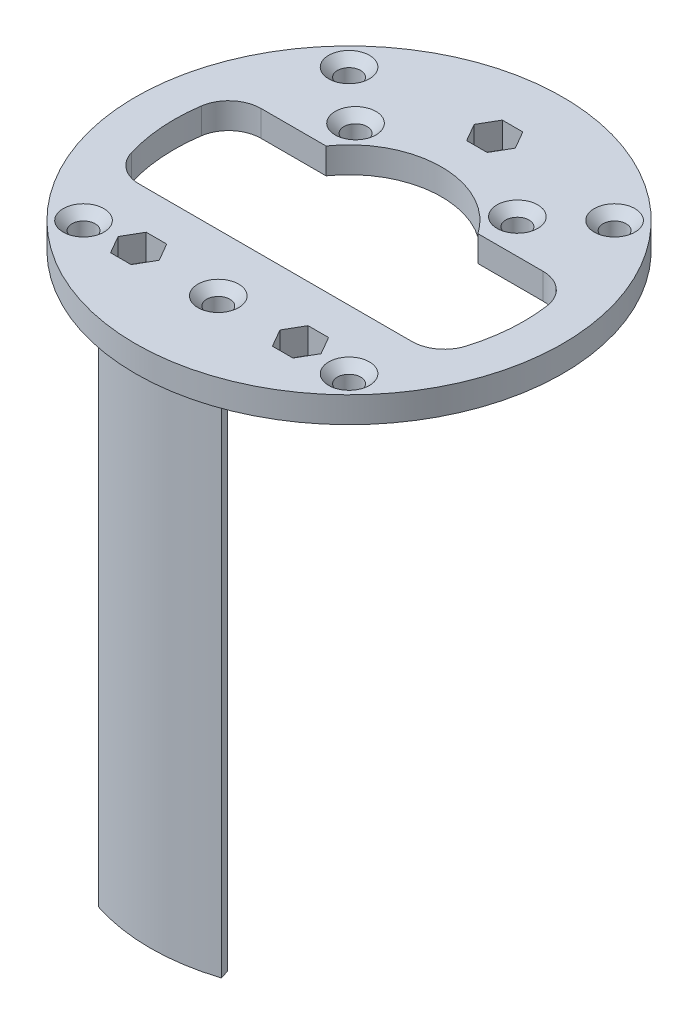
from build123d import *

# Parameters (mm, degrees)
SKETCH1_R                                       = 33
SKETCH1_R_2                                     = 27
BOSS_EXTRUDE1_DEPTH                             = 4
SALIENTE_EXTRUIR1_START                         = -4
SKETCH2_R                                       = 1.5
SALIENTE_EXTRUIR1_DEPTH                         = 4
CORTAR_EXTRUIR1_REACH                           = 48.84
CROQUIS1_R                                      = 1.75
CSK_FOR_M3_FLAT_HEAD_MACHINE_SCREW1_D           = 3.6
CSK_FOR_M3_FLAT_HEAD_MACHINE_SCREW1_CSINK_D     = 6.3
CSK_FOR_M3_FLAT_HEAD_MACHINE_SCREW1_CSINK_ANGLE = 90
CSK_FOR_M3_FLAT_HEAD_MACHINE_SCREW2_D           = 3.6
CSK_FOR_M3_FLAT_HEAD_MACHINE_SCREW2_CSINK_D     = 6.3
CSK_FOR_M3_FLAT_HEAD_MACHINE_SCREW2_CSINK_ANGLE = 90
FILLET1_R                                       = 5
BOSS_EXTRUDE2_DEPTH                             = 78
FILLET2_R                                       = 2


with BuildPart() as part:
    # Sketch1 → Boss-Extrude1 (new body)
    with BuildSketch(Plane(origin=(0, 0, 0), x_dir=(1, 0, 0), z_dir=(0, 1, 0))):
        with Locations(Location((0, 0, 0), (0, 0, 270))):
            Circle(SKETCH1_R)
        with Locations(Location((0, 0, 0), (0, 0, 270))):
            Circle(SKETCH1_R_2, mode=Mode.SUBTRACT)
    extrude(amount=BOSS_EXTRUDE1_DEPTH)

    # Sketch2 → Saliente-Extruir1 (add)
    # profile 1 of 2: a face of its own
    with BuildSketch(Plane(origin=(0, 4, 0), x_dir=(1, 0, 0), z_dir=(0, 1, 0)).offset(SALIENTE_EXTRUIR1_START)):
        with BuildLine():
            Line((-24.5, -11.346805718), (24.5, -11.346805718))
            ThreePointArc((24.5, -11.346805718), (0, -27), (-24.5, -11.346805718))
        make_face()
        with Locations(Location((0, -20.2, 0), (0, 0, 270))):
            Circle(SKETCH2_R, mode=Mode.SUBTRACT)
    # profile 2 of 2: a face of its own
    with BuildSketch(Plane(origin=(0, 4, 0), x_dir=(1, 0, 0), z_dir=(0, 1, 0)).offset(SALIENTE_EXTRUIR1_START)):
        with BuildLine():
            Line((-25.7325, 8.175478197), (-11.7325, 8.175478197))
            ThreePointArc((-11.7325, 8.175478197), (0, 14.3), (11.7325, 8.175478197))
            Line((11.7325, 8.175478197), (25.7325, 8.175478197))
            ThreePointArc((25.7325, 8.175478197), (0, 27), (-25.7325, 8.175478197))
        make_face()
        with Locations(Location((-12.5, 13.5, 0), (0, 0, 270))):
            Circle(SKETCH2_R, mode=Mode.SUBTRACT)
        with Locations(Location((12.5, 13.5, 0), (0, 0, 270))):
            Circle(SKETCH2_R, mode=Mode.SUBTRACT)
    extrude(amount=SALIENTE_EXTRUIR1_DEPTH)

    # Croquis1 → Cortar-Extruir1 (cut, up to next)
    with BuildSketch(Plane(origin=(0, 4, 0), x_dir=(1, 0, 0), z_dir=(0, 1, 0)), mode=Mode.PRIVATE) as cortar_extruir1_sk1:
        with Locations(Location((-20.506096654, 20.506096654, 0), (0, 0, 270))):
            Circle(CROQUIS1_R)
    cortar_extruir1_tool1 = extrude(cortar_extruir1_sk1.sketch, amount=-CORTAR_EXTRUIR1_REACH, mode=Mode.PRIVATE) & part.part
    # Croquis1 → Cortar-Extruir1 (cut, up to next)
    with BuildSketch(Plane(origin=(0, 4, 0), x_dir=(1, 0, 0), z_dir=(0, 1, 0)), mode=Mode.PRIVATE) as cortar_extruir1_sk2:
        with Locations(Location((20.506096654, 20.506096654, 0), (0, 0, 270))):
            Circle(CROQUIS1_R)
    cortar_extruir1_tool2 = extrude(cortar_extruir1_sk2.sketch, amount=-CORTAR_EXTRUIR1_REACH, mode=Mode.PRIVATE) & part.part
    # Croquis1 → Cortar-Extruir1 (cut, up to next)
    with BuildSketch(Plane(origin=(0, 4, 0), x_dir=(1, 0, 0), z_dir=(0, 1, 0)), mode=Mode.PRIVATE) as cortar_extruir1_sk3:
        with Locations(Location((-20.506096654, -20.506096654, 0), (0, 0, 270))):
            Circle(CROQUIS1_R)
    cortar_extruir1_tool3 = extrude(cortar_extruir1_sk3.sketch, amount=-CORTAR_EXTRUIR1_REACH, mode=Mode.PRIVATE) & part.part
    # Croquis1 → Cortar-Extruir1 (cut, up to next)
    with BuildSketch(Plane(origin=(0, 4, 0), x_dir=(1, 0, 0), z_dir=(0, 1, 0)), mode=Mode.PRIVATE) as cortar_extruir1_sk4:
        with Locations(Location((20.506096654, -20.506096654, 0), (0, 0, 270))):
            Circle(CROQUIS1_R)
    cortar_extruir1_tool4 = extrude(cortar_extruir1_sk4.sketch, amount=-CORTAR_EXTRUIR1_REACH, mode=Mode.PRIVATE) & part.part
    # Croquis1 → Cortar-Extruir1 (cut, up to next)
    with BuildSketch(Plane(origin=(0, 4, 0), x_dir=(1, 0, 0), z_dir=(0, 1, 0)), mode=Mode.PRIVATE) as cortar_extruir1_sk5:
        Polygon((-9.324573519, -20), (-10.91228676, -17.25), (-14.08771324, -17.25), (-15.675426481, -20), (-14.08771324, -22.75), (-10.91228676, -22.75), align=None)
    cortar_extruir1_tool5 = extrude(cortar_extruir1_sk5.sketch, amount=-CORTAR_EXTRUIR1_REACH, mode=Mode.PRIVATE) & part.part
    # Croquis1 → Cortar-Extruir1 (cut, up to next)
    with BuildSketch(Plane(origin=(0, 4, 0), x_dir=(1, 0, 0), z_dir=(0, 1, 0)), mode=Mode.PRIVATE) as cortar_extruir1_sk6:
        Polygon((15.675426481, -20), (14.08771324, -17.25), (10.91228676, -17.25), (9.324573519, -20), (10.91228676, -22.75), (14.08771324, -22.75), align=None)
    cortar_extruir1_tool6 = extrude(cortar_extruir1_sk6.sketch, amount=-CORTAR_EXTRUIR1_REACH, mode=Mode.PRIVATE) & part.part
    # Croquis1 → Cortar-Extruir1 (cut, up to next)
    with BuildSketch(Plane(origin=(0, 4, 0), x_dir=(1, 0, 0), z_dir=(0, 1, 0)), mode=Mode.PRIVATE) as cortar_extruir1_sk7:
        Polygon((3.175426481, 22.5), (1.58771324, 25.25), (-1.58771324, 25.25), (-3.175426481, 22.5), (-1.58771324, 19.75), (1.58771324, 19.75), align=None)
    cortar_extruir1_tool7 = extrude(cortar_extruir1_sk7.sketch, amount=-CORTAR_EXTRUIR1_REACH, mode=Mode.PRIVATE) & part.part
    add(cortar_extruir1_tool1.solids().sort_by_distance((-20.506097, 4, -20.506097))[0], mode=Mode.SUBTRACT)
    add(cortar_extruir1_tool2.solids().sort_by_distance((20.506097, 4, -20.506097))[0], mode=Mode.SUBTRACT)
    add(cortar_extruir1_tool3.solids().sort_by_distance((-20.506097, 4, 20.506097))[0], mode=Mode.SUBTRACT)
    add(cortar_extruir1_tool4.solids().sort_by_distance((20.506097, 4, 20.506097))[0], mode=Mode.SUBTRACT)
    add(cortar_extruir1_tool5.solids().sort_by_distance((-12.5, 4, 20))[0], mode=Mode.SUBTRACT)
    add(cortar_extruir1_tool6.solids().sort_by_distance((12.5, 4, 20))[0], mode=Mode.SUBTRACT)
    add(cortar_extruir1_tool7.solids().sort_by_distance((0, 4, -22.5))[0], mode=Mode.SUBTRACT)

    # CSK for M3 Flat Head Machine Screw1 (through all)
    with Locations(Plane(origin=(0, 4, 0), x_dir=(1, 0, 0), z_dir=(0, 1, 0))):
        with Locations((-20.506096654, 20.506096654), (20.506096654, 20.506096654), (20.506096654, -20.506096654), (-20.506096654, -20.506096654)):
            CounterSinkHole(CSK_FOR_M3_FLAT_HEAD_MACHINE_SCREW1_D / 2, CSK_FOR_M3_FLAT_HEAD_MACHINE_SCREW1_CSINK_D / 2, counter_sink_angle=CSK_FOR_M3_FLAT_HEAD_MACHINE_SCREW1_CSINK_ANGLE)

    # CSK for M3 Flat Head Machine Screw2 (through all)
    with Locations(Plane(origin=(0, 4, 0), x_dir=(1, 0, 0), z_dir=(0, 1, 0))):
        with Locations((-12.5, 13.5), (12.5, 13.5), (0, -20.2)):
            CounterSinkHole(CSK_FOR_M3_FLAT_HEAD_MACHINE_SCREW2_D / 2, CSK_FOR_M3_FLAT_HEAD_MACHINE_SCREW2_CSINK_D / 2, counter_sink_angle=CSK_FOR_M3_FLAT_HEAD_MACHINE_SCREW2_CSINK_ANGLE)

    # Fillet1
    fillet1_edges = [part.edges().sort_by_distance(p)[0] for p in [
        (-25.7325, 2, -8.175478197),
        (25.7325, 2, -8.175478197),
        (24.5, 2, 11.346805718),
        (-24.5, 2, 11.346805718),
    ]]
    fillet(fillet1_edges, radius=FILLET1_R)

    # Sketch8 → Boss-Extrude2 (add)
    with BuildSketch(Plane(origin=(0, 0, 0), x_dir=(-1, 0, 0), z_dir=(0, -1, 0))):
        with BuildLine():
            Line((-9.486821727, -29.19743505), (-9.023296236, -27.770850276))
            ThreePointArc((-9.023296236, -27.770850276), (0, -29.2), (9.023296236, -27.770850276))
            Line((9.023296236, -27.770850276), (9.486821727, -29.19743505))
            ThreePointArc((9.486821727, -29.19743505), (0, -30.7), (-9.486821727, -29.19743505))
        make_face()
    extrude(amount=BOSS_EXTRUDE2_DEPTH)

    # Fillet2
    fillet2_edges = [part.edges().sort_by_distance(p)[0] for p in [
        (0, 0, 29.2),
    ]]
    fillet(fillet2_edges, radius=FILLET2_R)


solid = part.part
